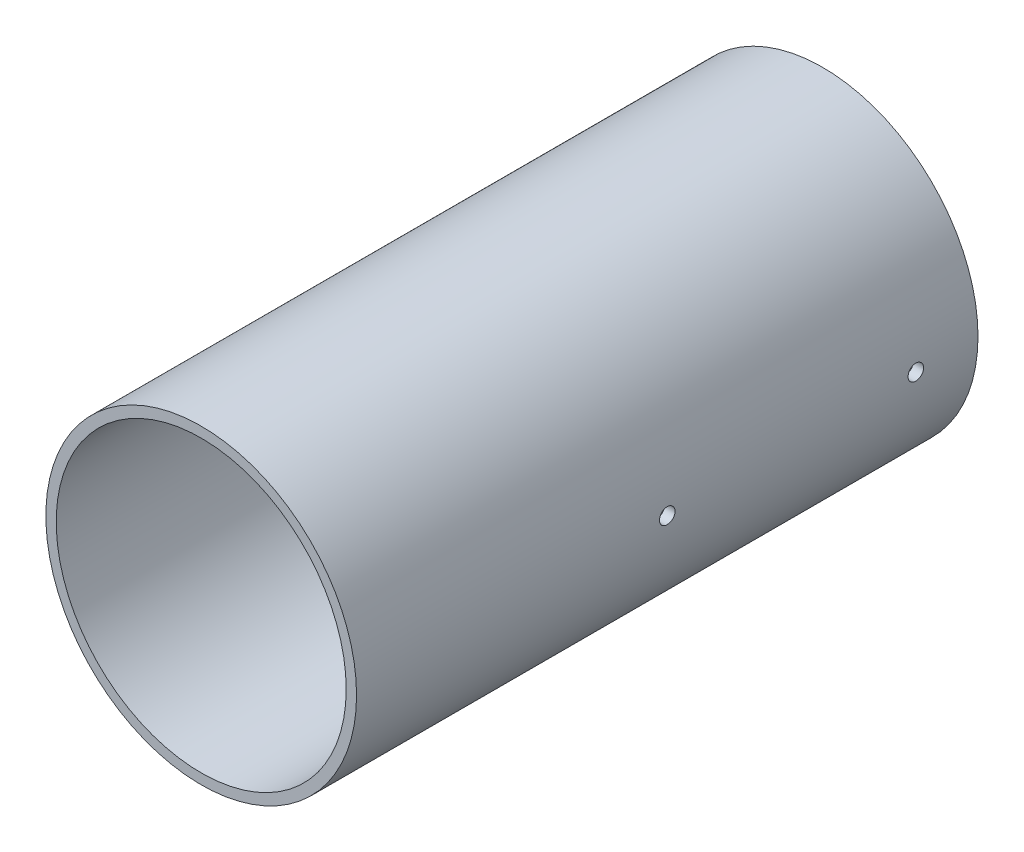
from build123d import *

# Parameters (mm, degrees)
SKETCH1_R               = 30
SKETCH1_R_2             = 28
BOSS_EXTRUDE1_DEPTH     = 120
CUT_EXTRUDE1_DEPTH      = 128.279220614
CUT_EXTRUDE1_DEPTH_BACK = 128.279220614
SKETCH2_R               = 1.5


with BuildPart() as part:
    # Sketch1 → Boss-Extrude1 (new body)
    with BuildSketch(Plane.XY):
        Circle(SKETCH1_R)
        Circle(SKETCH1_R_2, mode=Mode.SUBTRACT)
    extrude(amount=BOSS_EXTRUDE1_DEPTH)

    # Sketch2 → Cut-Extrude1 (cut, two sides: drawn at the far end of the back side and taken through both)
    with BuildSketch(Plane(origin=(0, 0, 0), x_dir=(0, 0, -1), z_dir=(1, 0, 0)).offset(-CUT_EXTRUDE1_DEPTH_BACK)):
        with Locations((-12, 0)):
            Circle(SKETCH2_R)
        with Locations((-60, 0)):
            Circle(SKETCH2_R)
    extrude(amount=CUT_EXTRUDE1_DEPTH + CUT_EXTRUDE1_DEPTH_BACK, mode=Mode.SUBTRACT)


solid = part.part
